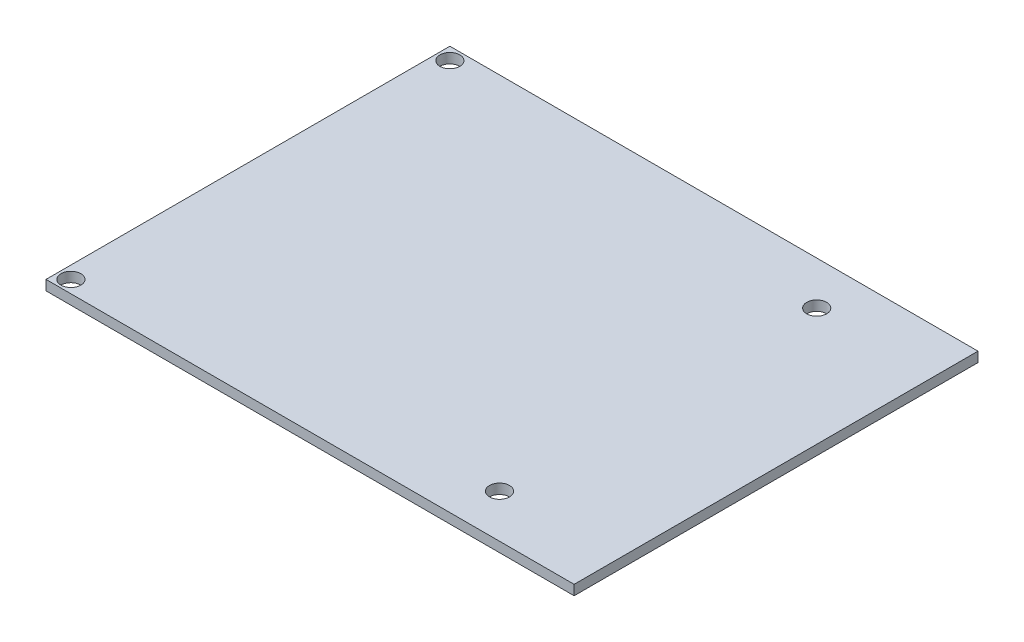
from build123d import *

# Parameters (mm, degrees)
SKETCH1_W           = 85
SKETCH1_H           = 65
SKETCH1_R           = 1.605
BOSS_EXTRUDE1_DEPTH = 1.6


with BuildPart() as part:
    # Sketch1 → Boss-Extrude1 (new body)
    with BuildSketch(Plane(origin=(0, 0, 0), x_dir=(1, 0, 0), z_dir=(0, 1, 0))):
        Rectangle(SKETCH1_W, SKETCH1_H)
        with Locations(Location((-40.495, 30.495, 0), (0, 0, 270))):
            Circle(SKETCH1_R, mode=Mode.SUBTRACT)
        with Locations(Location((23.515, 25.525, 0), (0, 0, 270))):
            Circle(SKETCH1_R, mode=Mode.SUBTRACT)
        with Locations(Location((23.515, -25.525, 0), (0, 0, 90))):
            Circle(SKETCH1_R, mode=Mode.SUBTRACT)
        with Locations(Location((-40.495, -30.495, 0), (0, 0, 90))):
            Circle(SKETCH1_R, mode=Mode.SUBTRACT)
    extrude(amount=BOSS_EXTRUDE1_DEPTH)


solid = part.part
